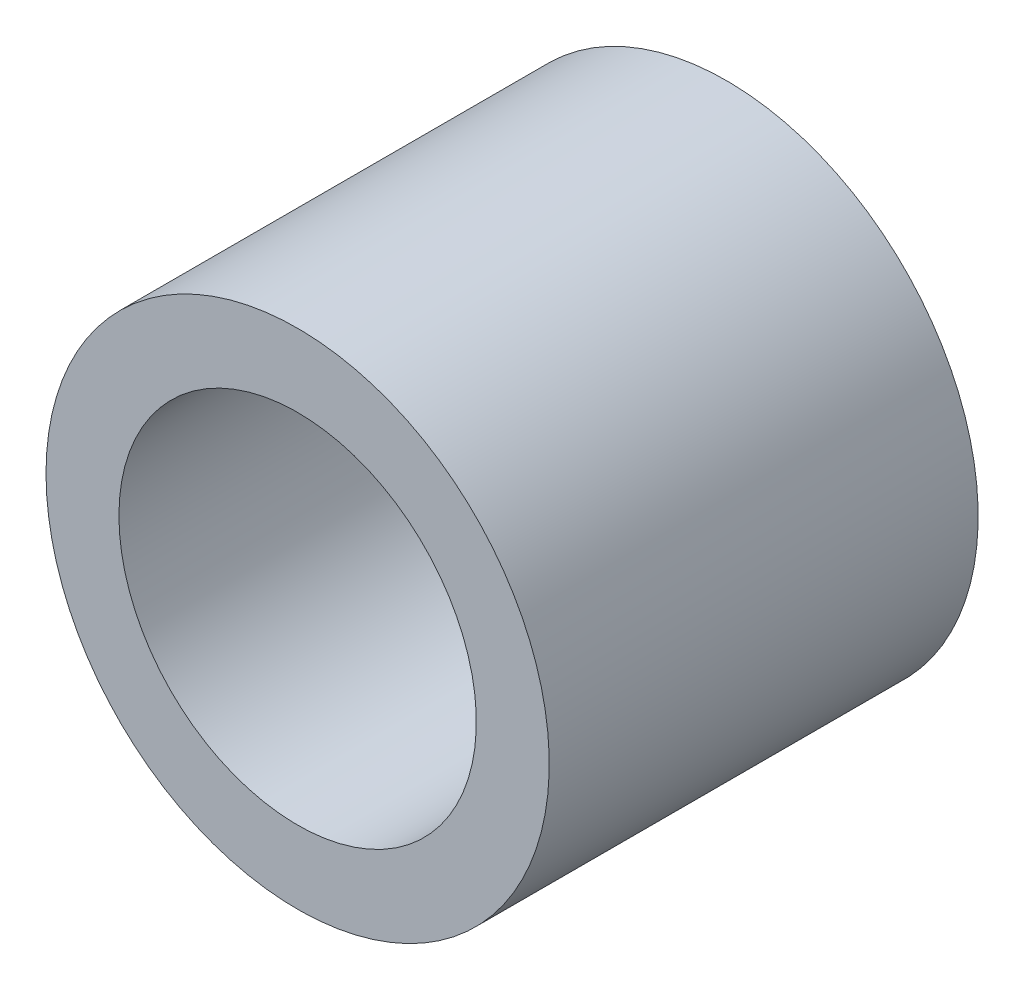
from build123d import *

# Parameters (mm, degrees)
SKETCH1_R      = 5.588
SKETCH1_R_2    = 3.96875
EXTRUDE1_DEPTH = 4.7625


with BuildPart() as part:
    # Sketch1 → Extrude1 (new, symmetric)
    with BuildSketch(Plane.XY):
        with Locations(Location((0, 0, 0), (0, 0, 180))):
            Circle(SKETCH1_R)
        with Locations(Location((0, 0, 0), (0, 0, 180))):
            Circle(SKETCH1_R_2, mode=Mode.SUBTRACT)
    extrude(amount=EXTRUDE1_DEPTH, both=True)


solid = part.part
